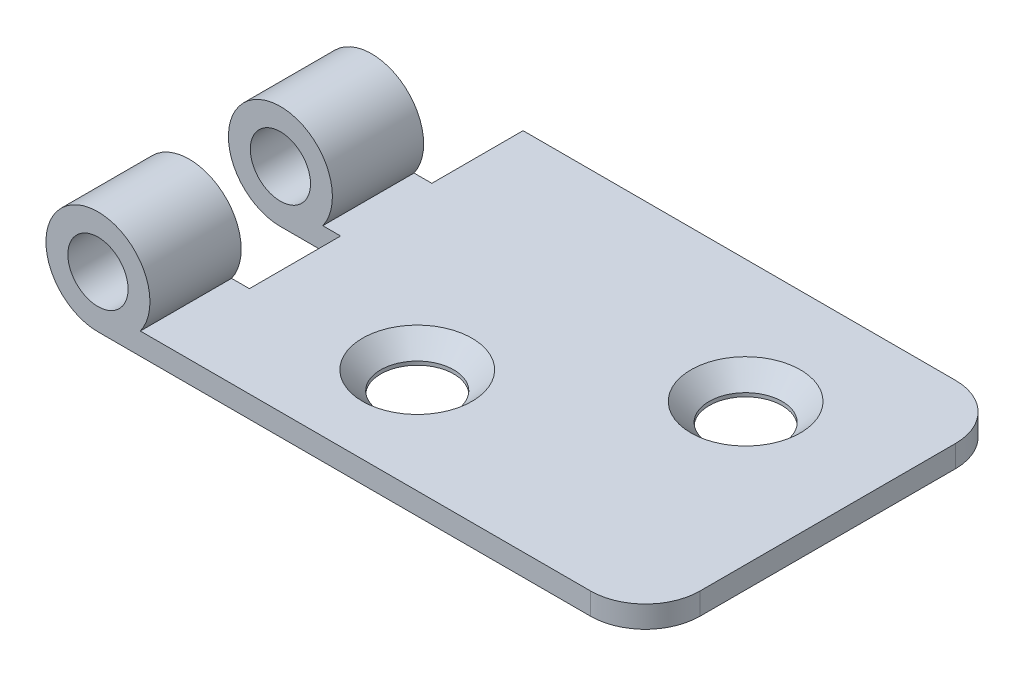
from build123d import *

# Parameters (mm, degrees)
ESQUISSE1_R                  = 1.65
BOSS_EXTRU_1_DEPTH           = 20
ENL_V_MAT_EXTRU_3_DEPTH      = 20
ENL_V_MAT_EXTRU_3_DEPTH_BACK = 20
ESQUISSE2_W                  = 10.952034034
ESQUISSE2_H                  = 5
CONG_1_R                     = 3
D_GAGEMENT_M41_D             = 4
D_GAGEMENT_M41_DEPTH         = 10
D_GAGEMENT_M41_CSINK_D       = 6
D_GAGEMENT_M41_CSINK_ANGLE   = 90
D_GAGEMENT_M41_TIP           = 1.201721238


with BuildPart() as part:
    # Esquisse1 → Boss.-Extru.1 (new body)
    with BuildSketch(Plane.XY):
        with BuildLine():
            Line((30, -1.65), (2.323790008, -1.65))
            ThreePointArc((2.323790008, -1.65), (-1.307669683, 2.532291452), (0, -2.85))
            Line((0, -2.85), (30, -2.85))
            Line((30, -2.85), (30, -1.65))
        make_face()
        Circle(ESQUISSE1_R, mode=Mode.SUBTRACT)
    extrude(amount=BOSS_EXTRU_1_DEPTH)

    # Esquisse2 → Enlèv. mat.-Extru.3 (cut, two sides: drawn at the far end of the back side and taken through both)
    with BuildSketch(Plane(origin=(0, -1.65, 0), x_dir=(1, 0, 0), z_dir=(0, 1, 0)).offset(-ENL_V_MAT_EXTRU_3_DEPTH_BACK)):
        with Locations((-2.176017017, -2.5)):
            Rectangle(ESQUISSE2_W, ESQUISSE2_H)
        with Locations((-2.176017017, -12.5)):
            Rectangle(ESQUISSE2_W, ESQUISSE2_H)
    extrude(amount=ENL_V_MAT_EXTRU_3_DEPTH + ENL_V_MAT_EXTRU_3_DEPTH_BACK, mode=Mode.SUBTRACT)

    # Congé1
    cong_1_edges = [part.edges().sort_by_distance(p)[0] for p in [
        (30, -2.25, 0),
        (30, -2.25, 20),
    ]]
    fillet(cong_1_edges, radius=CONG_1_R)

    # Dégagement M41
    with Locations(Plane(origin=(0, -1.65, 0), x_dir=(1, 0, 0), z_dir=(0, 1, 0))):
        with Locations((11.75, -14.25), (22.25, -6.75)):
            CounterSinkHole(D_GAGEMENT_M41_D / 2, D_GAGEMENT_M41_CSINK_D / 2, depth=D_GAGEMENT_M41_DEPTH, counter_sink_angle=D_GAGEMENT_M41_CSINK_ANGLE)
            with Locations((0, 0, -(D_GAGEMENT_M41_DEPTH + D_GAGEMENT_M41_TIP / 2))):  # 118° drill point
                Cone(0, D_GAGEMENT_M41_D / 2, D_GAGEMENT_M41_TIP, mode=Mode.SUBTRACT)


solid = part.part
